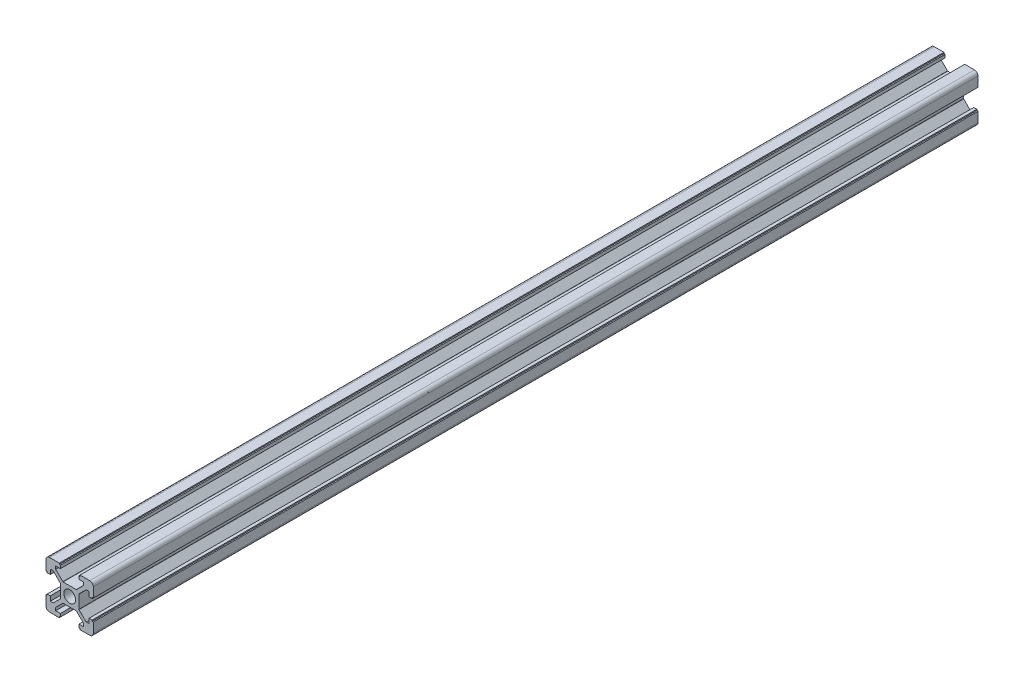
from build123d import *

# Parameters (mm, degrees)
SKETCH_1_R      = 2.5
EXTRUDE_1_DEPTH = 374
FILLET_1_R      = 1.5
FILLET_2_R      = 0.2


with BuildPart() as part:
    # 草图1 → 凸台-拉伸1 (new body)
    with BuildSketch(Plane.XY):
        Polygon((-10, 10), (-4.383887462, 10), (-4.4, 9.500259681), (-3.9, 9.500259681), (-3.9, 8.2), (-5.9, 8.2), (-5.9, 6.960660172), (-2.839608303, 3.900131414), (2.839471243, 3.900131414), (5.9, 6.960660172), (5.9, 8.2), (3.9, 8.2), (3.9, 9.500259681), (4.4, 9.500259681), (4.383887462, 10), (10, 10), (10, 4.383887462), (9.500259681, 4.4), (9.500259681, 3.9), (8.2, 3.9), (8.2, 5.9), (6.960660172, 5.9), (3.900131414, 2.839608303), (3.900131414, -2.839471243), (6.960660172, -5.9), (8.2, -5.9), (8.2, -3.9), (9.500259681, -3.9), (9.500259681, -4.4), (10, -4.383887462), (10, -10), (4.383887462, -10), (4.4, -9.500259681), (3.9, -9.500259681), (3.9, -8.2), (5.9, -8.2), (5.9, -6.960660172), (2.839471243, -3.899994348), (-2.839334176, -3.899994348), (-5.9, -6.960660172), (-5.9, -8.2), (-3.9, -8.2), (-3.9, -9.500259681), (-4.4, -9.500259681), (-4.383887462, -10), (-10, -10), (-10, -4.383887462), (-9.500259681, -4.4), (-9.500259681, -3.9), (-8.2, -3.9), (-8.2, -5.9), (-6.960660172, -5.9), (-3.899994348, -2.839471243), (-3.899994348, 2.839334176), (-6.960660172, 5.9), (-8.2, 5.9), (-8.2, 3.9), (-9.500259681, 3.9), (-9.500259681, 4.4), (-10, 4.383887462), align=None)
        Circle(SKETCH_1_R, mode=Mode.SUBTRACT)
    extrude(amount=EXTRUDE_1_DEPTH)

    # 圆角1
    fillet_1_edges = [part.edges().sort_by_distance(p)[0] for p in [
        (10, 10, 187),
        (10, -10, 187),
        (-10, -10, 187),
        (-10, 10, 187),
    ]]
    fillet(fillet_1_edges, radius=FILLET_1_R)

    # 圆角2
    fillet_2_edges = [part.edges().sort_by_distance(p)[0] for p in [
        (3.900131414, 2.839608303, 187),
        (3.900131414, -2.839471243, 187),
        (2.839471243, -3.899994348, 187),
        (-2.839334176, -3.899994348, 187),
        (-3.899994348, -2.839471243, 187),
        (-3.899994348, 2.839334176, 187),
        (-2.839608303, 3.900131414, 187),
        (2.839471243, 3.900131414, 187),
    ]]
    fillet(fillet_2_edges, radius=FILLET_2_R)


solid = part.part
